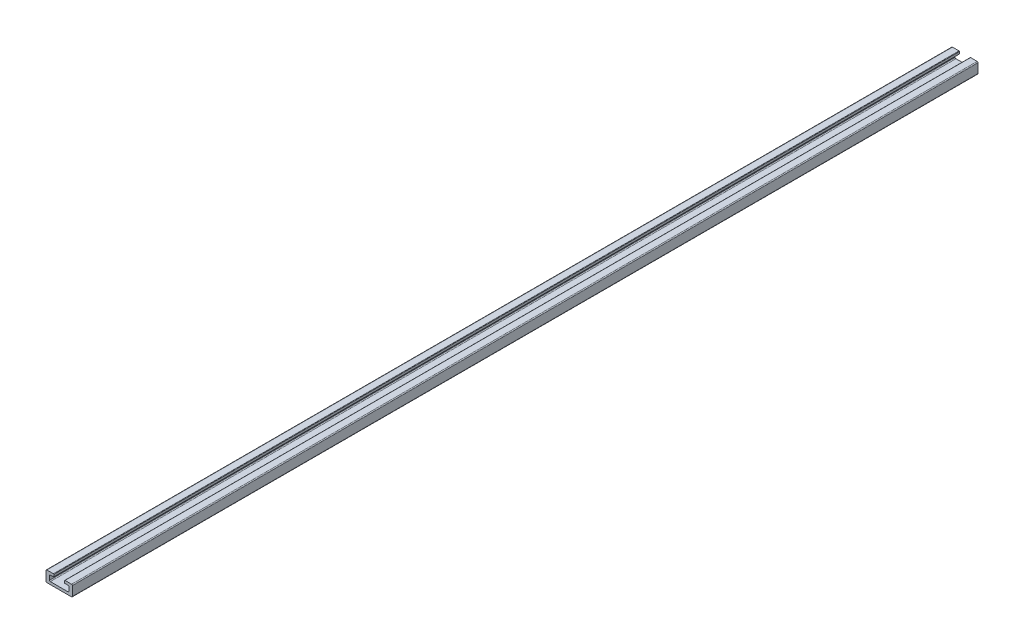
from build123d import *

# Parameters (mm, degrees)
BOSS_EXTRUDE1_DEPTH      = 35
BOSS_EXTRUDE1_DEPTH_BACK = 995
LPATTERN1_COUNT          = 25
LPATTERN1_PITCH          = 40


with BuildPart() as part:
    # Sketch1 → Boss-Extrude1 (new, two sides: drawn at the far end of the back side and taken through both)
    with BuildSketch(Plane.XY.offset(-BOSS_EXTRUDE1_DEPTH_BACK)):
        with BuildLine():
            Line((-15, 5.25), (-15, -5.25))
            ThreePointArc((-15, -5.25), (-14.707106781, -5.957106781), (-14, -6.25))
            Line((-14, -6.25), (14, -6.25))
            ThreePointArc((14, -6.25), (14.707106781, -5.957106781), (15, -5.25))
            Line((15, -5.25), (15, 5.25))
            ThreePointArc((15, 5.25), (14.707106781, 5.957106781), (14, 6.25))
            Line((14, 6.25), (6.6, 6.25))
            ThreePointArc((6.6, 6.25), (6.246446609, 6.103553391), (6.1, 5.75))
            Line((6.1, 5.75), (6.1, 3.45))
            ThreePointArc((6.1, 3.45), (6.158578644, 3.308578644), (6.3, 3.25))
            Line((6.3, 3.25), (10, 3.25))
            ThreePointArc((10, 3.25), (10.707106781, 2.957106781), (11, 2.25))
            Line((11, 2.25), (11, -2.25))
            ThreePointArc((11, -2.25), (10.707106781, -2.957106781), (10, -3.25))
            Line((10, -3.25), (-10, -3.25))
            ThreePointArc((-10, -3.25), (-10.707106781, -2.957106781), (-11, -2.25))
            Line((-11, -2.25), (-11, 2.25))
            ThreePointArc((-11, 2.25), (-10.707106781, 2.957106781), (-10, 3.25))
            Line((-10, 3.25), (-6.3, 3.25))
            ThreePointArc((-6.3, 3.25), (-6.158578644, 3.308578644), (-6.1, 3.45))
            Line((-6.1, 3.45), (-6.1, 5.75))
            ThreePointArc((-6.1, 5.75), (-6.246446609, 6.103553391), (-6.6, 6.25))
            Line((-6.6, 6.25), (-14, 6.25))
            ThreePointArc((-14, 6.25), (-14.707106781, 5.957106781), (-15, 5.25))
        make_face()
    extrude(amount=BOSS_EXTRUDE1_DEPTH + BOSS_EXTRUDE1_DEPTH_BACK)

    # Sketch2 → Cut-Revolve1 (revolve, cut)
    with BuildSketch(Plane(origin=(0, 0, 0), x_dir=(0, 0, -1), z_dir=(1, 0, 0)), mode=Mode.PRIVATE) as cut_revolve1_sk:
        Polygon((-20, -3.25), (-17, -3.25), (-17, -5.25), (-18.25, -5.25), (-18.25, -6.25), (-20, -6.25), align=None)
    revolve(cut_revolve1_sk.sketch.rotate(Axis((0, -6.25, 20), (0, 1, 0)), 180), axis=Axis((0, -6.25, 20), (0, 1, 0)), mode=Mode.SUBTRACT)

    # Sketch3 → Cut-Revolve2 (revolve, cut)
    with BuildSketch(Plane(origin=(0, 0, 0), x_dir=(0, 0, -1), z_dir=(1, 0, 0)), mode=Mode.PRIVATE) as cut_revolve2_sk:
        Polygon((20, -3.25), (23, -3.25), (23, -5.25), (21.75, -5.25), (21.75, -6.25), (20, -6.25), align=None)
    cut_revolve2 = revolve(cut_revolve2_sk.sketch.rotate(Axis((0, -6.25, -20), (0, 1, 0)), 180), axis=Axis((0, -6.25, -20), (0, 1, 0)), mode=Mode.SUBTRACT)

    # LPattern1: Cut-Revolve2 ×25
    with Locations(*[(0, 0, -i * LPATTERN1_PITCH) for i in range(1, LPATTERN1_COUNT)]):
        add(cut_revolve2, mode=Mode.SUBTRACT)


solid = part.part
